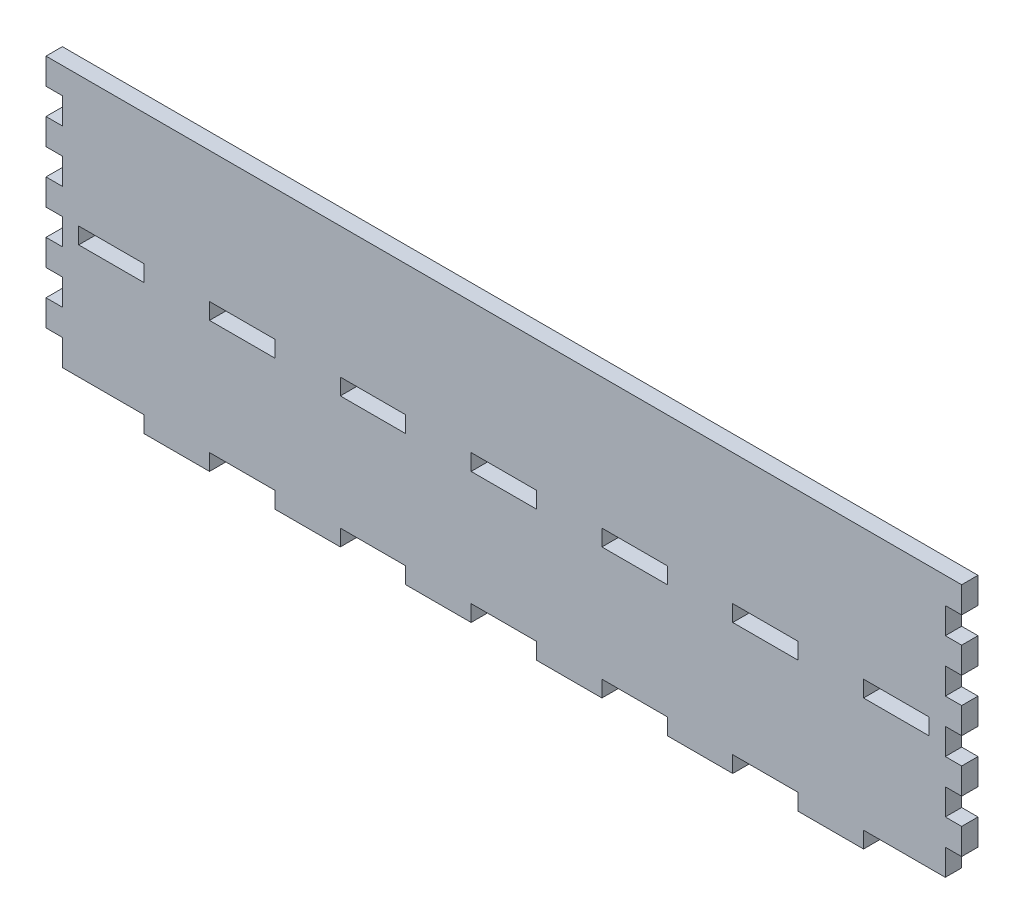
from build123d import *

# Parameters (mm, degrees)
ESQUISSE1_W                     = 355.6
ESQUISSE1_H                     = 107.95
BOSS_EXTRU_1_DEPTH              = 6.35
ESQUISSE4_W                     = 6.35
ESQUISSE4_H                     = 10.16
ENL_V_MAT_EXTRU_3_DEPTH         = 6.35
R_P_TITION_LIN_AIRE2_COUNT      = 7
R_P_TITION_LIN_AIRE2_PITCH      = 20.32
R_P_TITION_LIN_AIRE2_COUNT_DIR2 = 2
R_P_TITION_LIN_AIRE2_PITCH_DIR2 = 349.25
ESQUISSE5_W                     = 25.4
ESQUISSE5_H                     = 6.35
ENL_V_MAT_EXTRU_4_DEPTH         = 6.35
R_P_TITION_LIN_AIRE3_COUNT      = 7
R_P_TITION_LIN_AIRE3_PITCH      = 50.8
ESQUISSE6_W                     = 12.7
ESQUISSE6_H                     = 6.35
ENL_V_MAT_EXTRU_5_DEPTH         = 6.35
ESQUISSE8_W                     = 12.7
ESQUISSE8_H                     = 6.35
ENL_V_MAT_EXTRU_7_DEPTH         = 6.35
ESQUISSE9_W                     = 25.4
ESQUISSE9_H                     = 6.35
ENL_V_MAT_EXTRU_8_DEPTH         = 6.35
R_P_TITION_LIN_AIRE6_COUNT      = 7
R_P_TITION_LIN_AIRE6_PITCH      = 50.8


with BuildPart() as part:
    # Esquisse1 → Boss.-Extru.1 (new body)
    with BuildSketch(Plane.XY):
        Rectangle(ESQUISSE1_W, ESQUISSE1_H)
    extrude(amount=BOSS_EXTRU_1_DEPTH)

    # Esquisse4 → Enlèv. mat.-Extru.3 (cut)
    with BuildSketch(Plane.XY.offset(6.35)):
        with Locations((-174.625, 38.735)):
            Rectangle(ESQUISSE4_W, ESQUISSE4_H)
    enl_v_mat_extru_3 = extrude(amount=-ENL_V_MAT_EXTRU_3_DEPTH, mode=Mode.SUBTRACT)

    # Répétition linéaire2: Enl_v. mat.-Extru.3 7 × 2
    with Locations(*[(j * R_P_TITION_LIN_AIRE2_PITCH_DIR2, -i * R_P_TITION_LIN_AIRE2_PITCH, 0) for i in range(R_P_TITION_LIN_AIRE2_COUNT) for j in range(R_P_TITION_LIN_AIRE2_COUNT_DIR2) if (i, j) != (0, 0)]):
        add(enl_v_mat_extru_3, mode=Mode.SUBTRACT)

    # Esquisse5 → Enlèv. mat.-Extru.4 (cut)
    with BuildSketch(Plane.XY.offset(6.35)):
        with Locations((-152.4, -50.8)):
            Rectangle(ESQUISSE5_W, ESQUISSE5_H)
    enl_v_mat_extru_4 = extrude(amount=-ENL_V_MAT_EXTRU_4_DEPTH, mode=Mode.SUBTRACT)

    # Répétition linéaire3: Enlèv. mat.-Extru.4 ×7
    with Locations(*[(i * R_P_TITION_LIN_AIRE3_PITCH, 0, 0) for i in range(1, R_P_TITION_LIN_AIRE3_COUNT)]):
        add(enl_v_mat_extru_4, mode=Mode.SUBTRACT)

    # Esquisse6 → Enlèv. mat.-Extru.5 (cut)
    with BuildSketch(Plane.XY.offset(6.35)):
        with Locations((-171.45, -50.8)):
            Rectangle(ESQUISSE6_W, ESQUISSE6_H)
    extrude(amount=-ENL_V_MAT_EXTRU_5_DEPTH, mode=Mode.SUBTRACT)

    # Esquisse8 → Enlèv. mat.-Extru.7 (cut)
    with BuildSketch(Plane.XY.offset(6.35)):
        with Locations((171.45, -50.8)):
            Rectangle(ESQUISSE8_W, ESQUISSE8_H)
    extrude(amount=-ENL_V_MAT_EXTRU_7_DEPTH, mode=Mode.SUBTRACT)

    # Esquisse9 → Enlèv. mat.-Extru.8 (cut)
    with BuildSketch(Plane.XY.offset(6.35)):
        with Locations((-152.4, 0)):
            Rectangle(ESQUISSE9_W, ESQUISSE9_H)
    enl_v_mat_extru_8 = extrude(amount=-ENL_V_MAT_EXTRU_8_DEPTH, mode=Mode.SUBTRACT)

    # Répétition linéaire6: Enlèv. mat.-Extru.8 ×7
    with Locations(*[(i * R_P_TITION_LIN_AIRE6_PITCH, 0, 0) for i in range(1, R_P_TITION_LIN_AIRE6_COUNT)]):
        add(enl_v_mat_extru_8, mode=Mode.SUBTRACT)


solid = part.part
